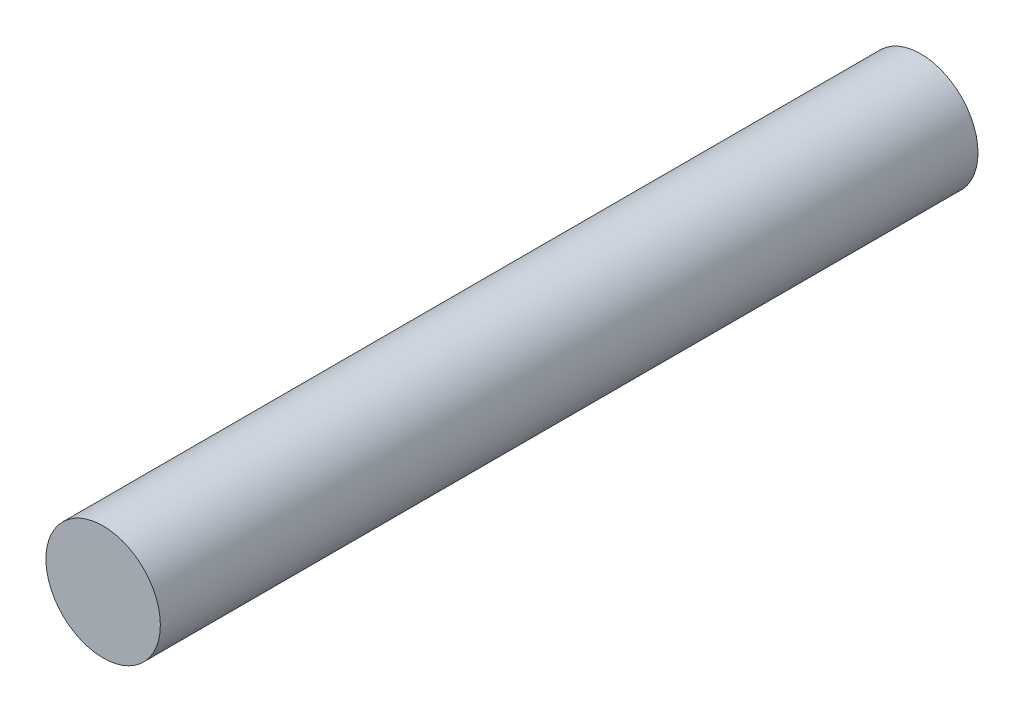
from build123d import *

# Parameters (mm, degrees)
SKETCH_1_R      = 1.75
EXTRUDE_1_DEPTH = 25


with BuildPart() as part:
    # 草图1 → 凸台-拉伸1 (new body)
    with BuildSketch(Plane.XY):
        Circle(SKETCH_1_R)
    extrude(amount=EXTRUDE_1_DEPTH)


solid = part.part
